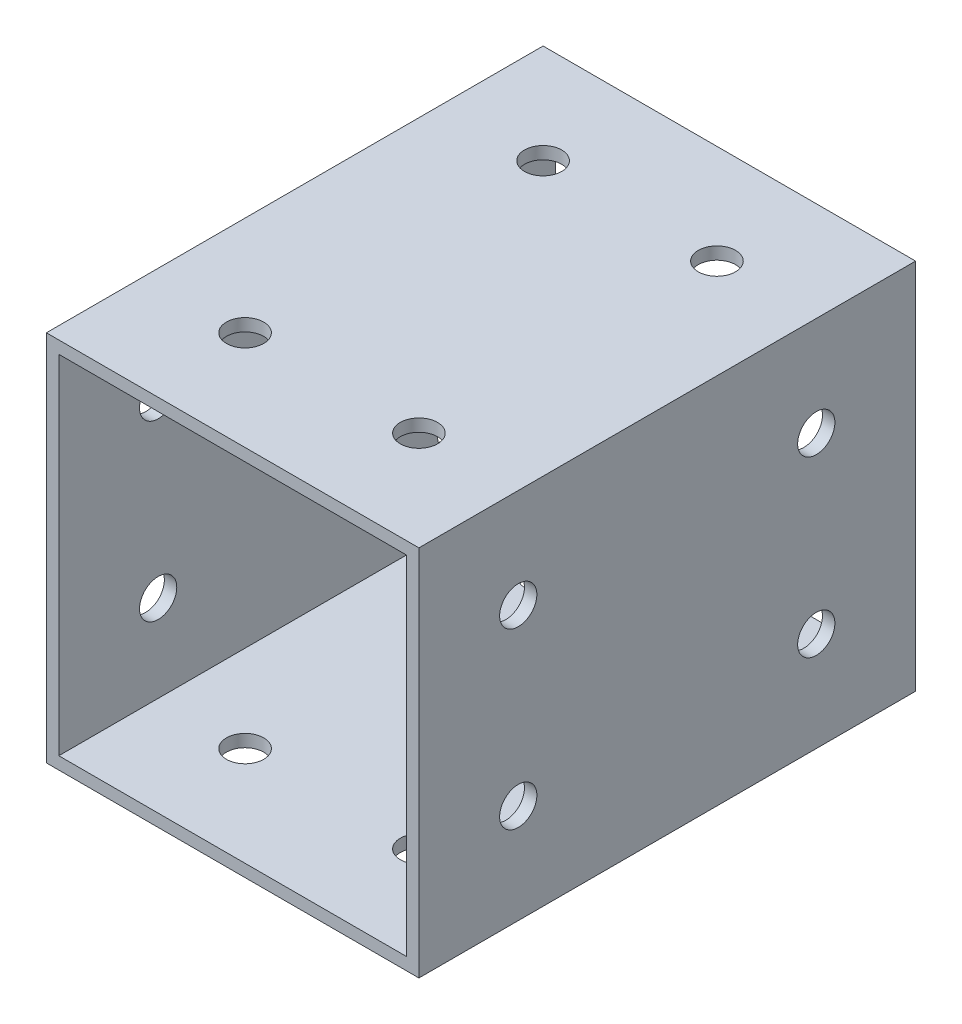
from build123d import *

# Parameters (mm, degrees)
SKETCH_1_W          = 30
SKETCH_1_H          = 30
SKETCH_1_W_2        = 28
SKETCH_1_H_2        = 28
EXTRUDE_1_DEPTH     = 40
SKETCH_2_R          = 1.5
CUT_EXTRUDE_1_DEPTH = 53.201532545
SKETCH_3_R          = 1.5
CUT_EXTRUDE_2_DEPTH = 53.201532545


with BuildPart() as part:
    # 草图1 → 凸台-拉伸1 (new body)
    with BuildSketch(Plane.XY):
        Rectangle(SKETCH_1_W, SKETCH_1_H)
        Rectangle(SKETCH_1_W_2, SKETCH_1_H_2, mode=Mode.SUBTRACT)
    extrude(amount=EXTRUDE_1_DEPTH)

    # 草图2 → 切除-拉伸1 (cut, through all)
    with BuildSketch(Plane.ZY.offset(15)):
        with Locations((32, -7)):
            Circle(SKETCH_2_R)
        with Locations((8, -7)):
            Circle(SKETCH_2_R)
        with Locations((32, 7)):
            Circle(SKETCH_2_R)
        with Locations((8, 7)):
            Circle(SKETCH_2_R)
    extrude(amount=-CUT_EXTRUDE_1_DEPTH, mode=Mode.SUBTRACT)

    # 草图3 → 切除-拉伸2 (cut, through all)
    with BuildSketch(Plane(origin=(0, 15, 0), x_dir=(1, 0, 0), z_dir=(0, 1, 0))):
        with Locations(Location((7, -32, 0), (0, 0, 270))):
            Circle(SKETCH_3_R)
        with Locations(Location((-7, -32, 0), (0, 0, 270))):
            Circle(SKETCH_3_R)
        with Locations(Location((7, -8, 0), (0, 0, 270))):
            Circle(SKETCH_3_R)
        with Locations(Location((-7, -8, 0), (0, 0, 270))):
            Circle(SKETCH_3_R)
    extrude(amount=-CUT_EXTRUDE_2_DEPTH, mode=Mode.SUBTRACT)


solid = part.part
